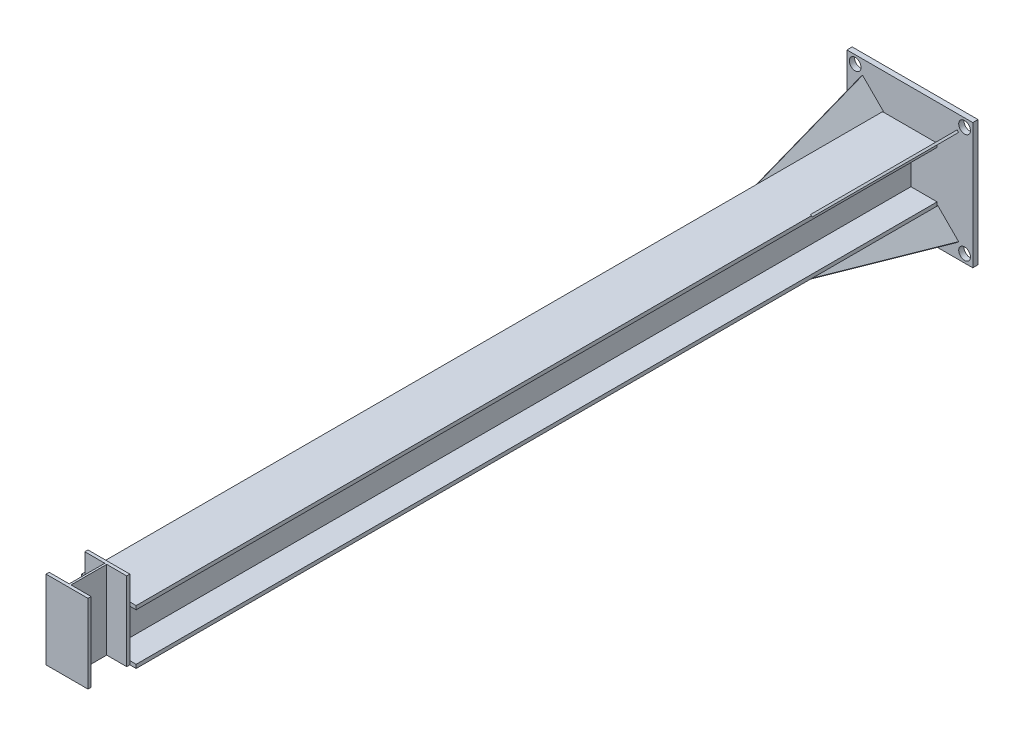
from build123d import *

# Parameters (mm, degrees)
BOSS_EXTRUDE1_DEPTH = 3820
SKETCH3_W           = 600
SKETCH3_H           = 600
BOSS_EXTRUDE2_DEPTH = 25
BOSS_EXTRUDE5_DEPTH = 5
CIRPATTERN3_COUNT   = 4
BOSS_EXTRUDE6_DEPTH = 375
SKETCH7_R           = 28
CUT_EXTRUDE2_DEPTH  = 4066.734865925


with BuildPart() as part:
    # Sketch1 → Boss-Extrude1 (new body)
    with BuildSketch(Plane.XY):
        Polygon((-125, 242.5), (0, 242.5), (0, 260.0000001), (-260, 260.0000001), (-260, 242.5), (-135, 242.5), (-135, 17.5), (-260, 17.5), (-260, 0), (0, 0), (0, 17.5), (-125, 17.5), align=None)
    extrude(amount=BOSS_EXTRUDE1_DEPTH)


with BuildPart() as body_2:
    # Sketch3 → Boss-Extrude2 (new body)
    with BuildSketch(Plane.XY):
        with Locations((-130, 130)):
            Rectangle(SKETCH3_W, SKETCH3_H)
    extrude(amount=-BOSS_EXTRUDE2_DEPTH)

    # Sketch7 → Cut-Extrude2 (cut, through all)
    with BuildSketch(Plane.XY):
        with Locations((-391, 391)):
            Circle(SKETCH7_R)
        with Locations((131, 391)):
            Circle(SKETCH7_R)
        with Locations((131, -131)):
            Circle(SKETCH7_R)
        with Locations((-391, -131)):
            Circle(SKETCH7_R)
    extrude(amount=-CUT_EXTRUDE2_DEPTH, mode=Mode.SUBTRACT)


with BuildPart() as body_3:
    # Sketch5 → Boss-Extrude5 (new, symmetric)
    with BuildSketch(Plane(origin=(0, 0, 0), x_dir=(0.7071067811865477, -0.7071067811865475, 0), z_dir=(-0.7071067811865475, -0.7071067811865477, 0))):
        Polygon((0, 0), (140, 0), (0, 600), align=None)
    extrude(amount=BOSS_EXTRUDE5_DEPTH, both=True)


with BuildPart() as cirpattern3_1:
    # CirPattern3: pattern copy
    add(body_3.part.rotate(Axis((-130, 130.000000298, 3820), (0, 0, -1)), 1 * 360 / CIRPATTERN3_COUNT))


with BuildPart() as cirpattern3_2:
    # CirPattern3: pattern copy
    add(body_3.part.rotate(Axis((-130, 130.000000298, 3820), (0, 0, -1)), 2 * 360 / CIRPATTERN3_COUNT))


with BuildPart() as cirpattern3_3:
    # CirPattern3: pattern copy
    add(body_3.part.rotate(Axis((-130, 130.000000298, 3820), (0, 0, -1)), 3 * 360 / CIRPATTERN3_COUNT))


with BuildPart() as body_7:
    # Sketch6 → Boss-Extrude6 (new body)
    with BuildSketch(Plane.XZ):
        Polygon((-230, 4020), (-30, 4020), (-30, 4005), (-125.5, 4005), (-125.5, 3835), (-30, 3835), (-30, 3820), (-230, 3820), (-230, 3835), (-134.5, 3835), (-134.5, 4005), (-230, 4005), align=None)
    extrude(amount=-BOSS_EXTRUDE6_DEPTH)


solid = Compound([part.part, body_2.part, body_3.part, cirpattern3_1.part, cirpattern3_2.part, cirpattern3_3.part, body_7.part])
